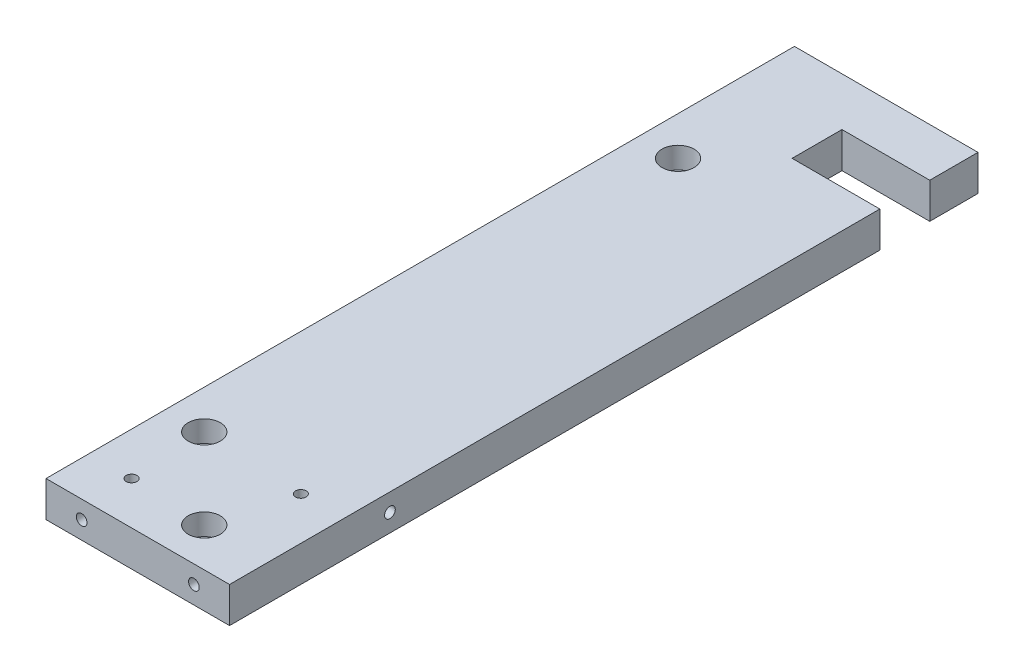
from build123d import *

# Parameters (mm, degrees)
EXTRUDE_1_DEPTH     = 5
SKETCH_1_12_R       = 1.5
CUT_EXTRUDE_1_DEPTH = 109.226902848
CUT_EXTRUDE_START   = 5
SKETCH_1_13_R       = 2.25
CUT_EXTRUDE_3_DEPTH = 3
SKETCH_2_R          = 0.75
CUT_EXTRUDE_4_DEPTH = 2
SKETCH_3_R          = 0.75
CUT_EXTRUDE_5_DEPTH = 2
SKETCH_4_R          = 0.75
CUT_EXTRUDE_6_DEPTH = 109.226902848
SKETCH_5_R          = 0.75
CUT_EXTRUDE_7_DEPTH = 2


with BuildPart() as part:
    # 草图1 → 凸台-拉伸1 (new body)
    with BuildSketch(Plane(origin=(0, 0, 0), x_dir=(1, 0, 0), z_dir=(0, 1, 0))):
        Polygon((-25.75, 0), (0, 0), (0, 91.231745931), (-12.313708499, 91.231745931), (-12.313708499, 98.231745931), (0, 98.231745931), (0, 105), (-25.75, 105), align=None)
    extrude(amount=EXTRUDE_1_DEPTH)

    # 草图1<12> → 切除-拉伸1 (cut, through all)
    with BuildSketch(Plane(origin=(0, 0, 0), x_dir=(1, 0, 0), z_dir=(0, 1, 0))):
        with Locations(Location((-20.313708499, 83.231745931, 0), (0, 0, 270))):
            Circle(SKETCH_1_12_R)
        with Locations(Location((-20.313708499, 16.763708499, 0), (0, 0, 270))):
            Circle(SKETCH_1_12_R)
        with Locations(Location((-9, 5.45, 0), (0, 0, 270))):
            Circle(SKETCH_1_12_R)
    extrude(amount=CUT_EXTRUDE_1_DEPTH, mode=Mode.SUBTRACT)

    # 草图1<13> → 切除-拉伸3 (cut)
    with BuildSketch(Plane(origin=(0, 0, 0), x_dir=(1, 0, 0), z_dir=(0, 1, 0)).offset(CUT_EXTRUDE_START)):
        with Locations(Location((-20.313708499, 83.231745931, 0), (0, 0, 270))):
            Circle(SKETCH_1_13_R)
        with Locations(Location((-9, 5.45, 0), (0, 0, 270))):
            Circle(SKETCH_1_13_R)
        with Locations(Location((-20.313708499, 16.763708499, 0), (0, 0, 270))):
            Circle(SKETCH_1_13_R)
    extrude(amount=-CUT_EXTRUDE_3_DEPTH, mode=Mode.SUBTRACT)

    # 草图2 → 切除-拉伸4 (cut)
    with BuildSketch(Plane.XY):
        with Locations((-20.75, 2.5)):
            Circle(SKETCH_2_R)
        with Locations((-5, 2.5)):
            Circle(SKETCH_2_R)
    extrude(amount=-CUT_EXTRUDE_4_DEPTH, mode=Mode.SUBTRACT)

    # 草图3 → 切除-拉伸5 (cut)
    with BuildSketch(Plane(origin=(0, 0, 0), x_dir=(0, 0, -1), z_dir=(1, 0, 0))):
        with Locations((22.5, 2.5)):
            Circle(SKETCH_3_R)
    extrude(amount=-CUT_EXTRUDE_5_DEPTH, mode=Mode.SUBTRACT)

    # 草图4 → 切除-拉伸6 (cut, through all)
    with BuildSketch(Plane(origin=(0, 5, 0), x_dir=(1, 0, 0), z_dir=(0, 1, 0))):
        with Locations(Location((-6, 16, 0), (0, 0, 270))):
            Circle(SKETCH_4_R)
        with Locations(Location((-19.75, 6, 0), (0, 0, 270))):
            Circle(SKETCH_4_R)
    extrude(amount=-CUT_EXTRUDE_6_DEPTH, mode=Mode.SUBTRACT)

    # 草图5 → 切除-拉伸7 (cut)
    with BuildSketch(Plane.ZY.offset(25.75)):
        with Locations((-10, 2.5)):
            Circle(SKETCH_5_R)
        with Locations((-50, 2.5)):
            Circle(SKETCH_5_R)
        with Locations((-70, 2.5)):
            Circle(SKETCH_5_R)
        with Locations((-90, 2.5)):
            Circle(SKETCH_5_R)
        with Locations((-30, 2.5)):
            Circle(SKETCH_5_R)
    extrude(amount=-CUT_EXTRUDE_7_DEPTH, mode=Mode.SUBTRACT)


solid = part.part
